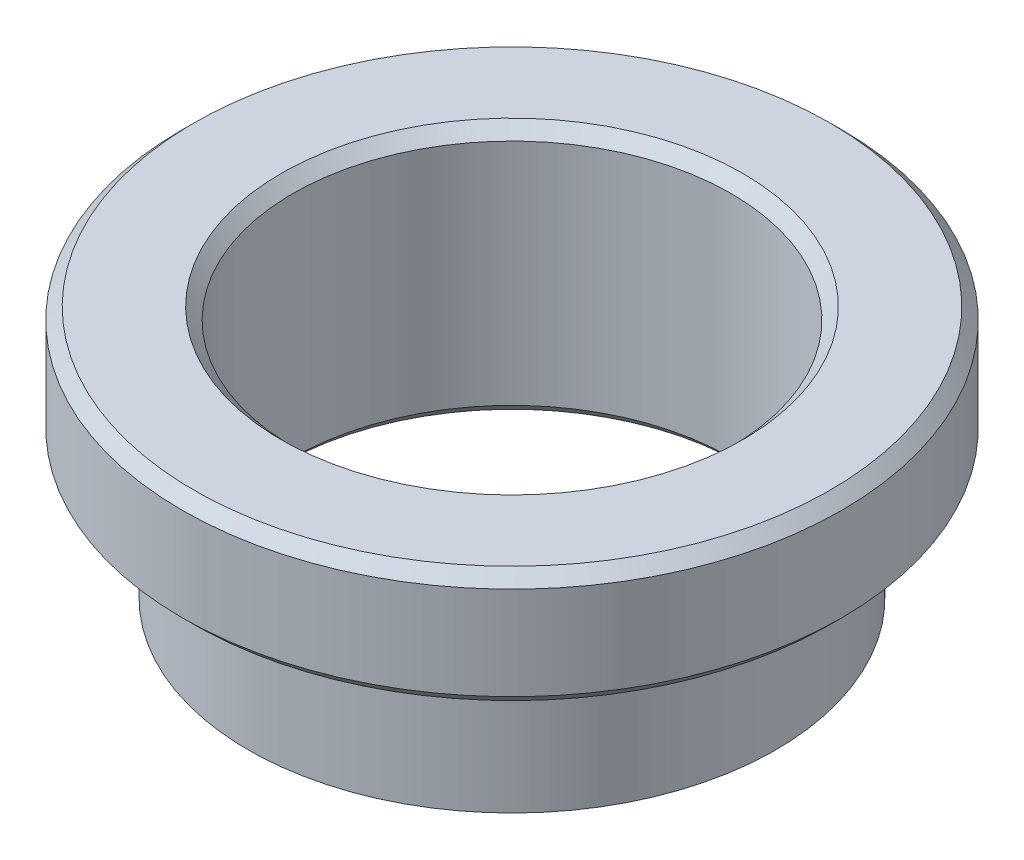
from build123d import *


with BuildPart() as part:
    # Эскиз2 → Повернуть1 (revolve)
    with BuildSketch(Plane.XY, mode=Mode.PRIVATE) as revolve_1_sk:
        Polygon((5.95, 0), (5.65, 0.3), (5.65, 6.2), (5.95, 6.5), (8.2, 6.5), (8.5, 6.2), (8.5, 3.8), (8.2, 3.5), (6.8, 3.5), (6.8, 0), align=None)
    revolve(revolve_1_sk.sketch.rotate(Axis((0, 0, 0), (0, 1, 0)), 90), axis=Axis((0, 0, 0), (0, 1, 0)))


solid = part.part
